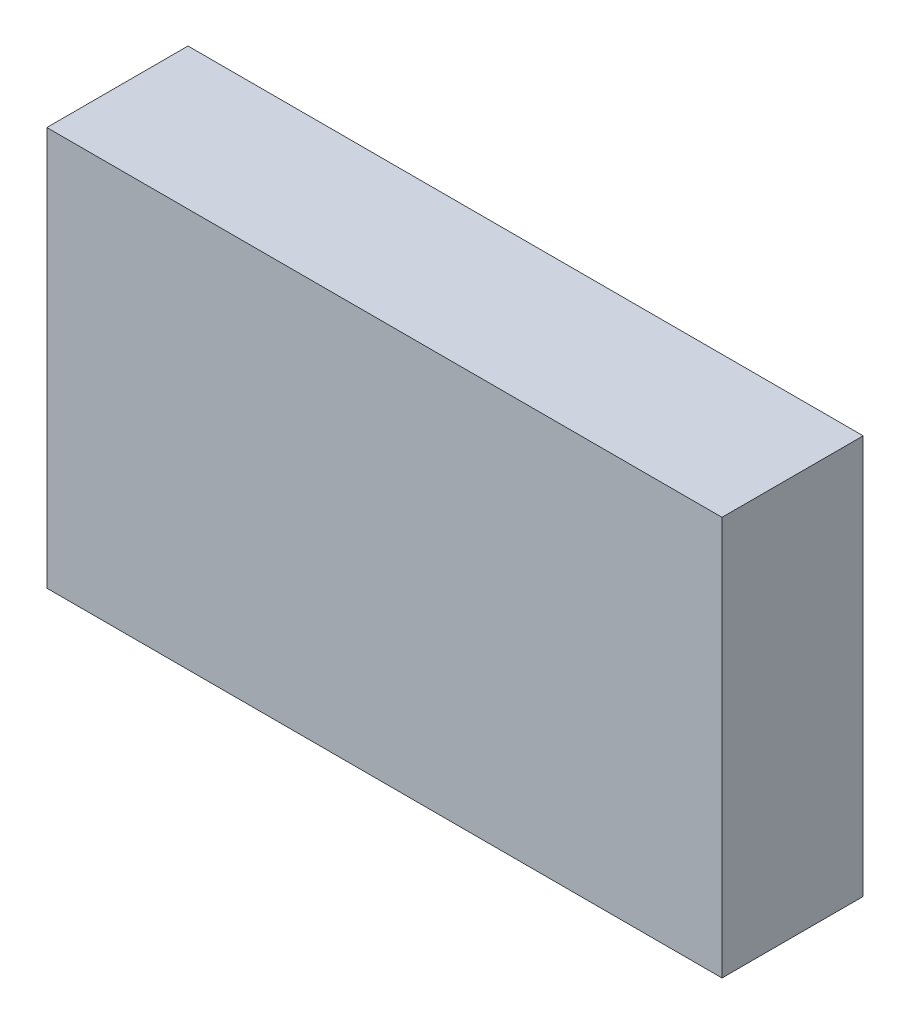
from build123d import *

# Parameters (mm, degrees)
SKETCH2_W           = 110
SKETCH2_H           = 65
BOSS_EXTRUDE1_DEPTH = 23


with BuildPart() as part:
    # Sketch2 → Boss-Extrude1 (new body)
    with BuildSketch(Plane.XY):
        with Locations((55, 32.5)):
            Rectangle(SKETCH2_W, SKETCH2_H)
    extrude(amount=BOSS_EXTRUDE1_DEPTH)


solid = part.part
